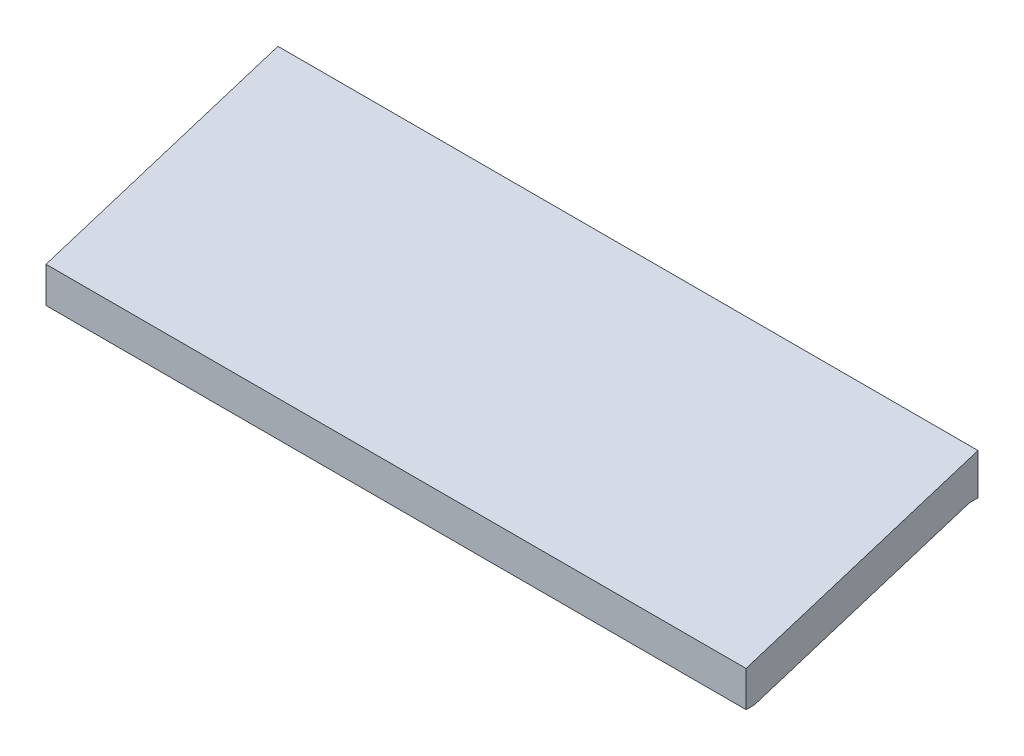
from build123d import *

# Parameters (mm, degrees)
BOSS_EXTRUDE2_DEPTH = 166
BOSS_EXTRUDE3_DEPTH = 2
BOSS_EXTRUDE4_DEPTH = 2


with BuildPart() as part:
    # Sketch2 → Boss-Extrude2 (new body)
    with BuildSketch(Plane(origin=(0, 0, 0), x_dir=(0, 0, -1), z_dir=(1, 0, 0))):
        Polygon((51, -1.737908105), (51, -8.737908105), (53, -8.737908105), (53, -1.737908105), (53, 0.985657074), (50.401319851, 0.17038487), (-0.598680149, -15.82961513), (-2, -16.269244887), (-2, -17.737908105), (-2, -24.737908105), (0, -24.737908105), (0, -22.737908105), (0, -17.737908105), align=None)
    extrude(amount=BOSS_EXTRUDE2_DEPTH)

    # Sketch3 → Boss-Extrude3 (add)
    with BuildSketch(Plane.ZY):
        Polygon((-51, -1.737908105), (0, -17.737908105), (0, -24.737908105), (-51, -8.737908105), align=None)
    extrude(amount=-BOSS_EXTRUDE3_DEPTH)

    # Sketch4 → Boss-Extrude4 (add)
    with BuildSketch(Plane(origin=(166, 0, 0), x_dir=(0, 0, -1), z_dir=(1, 0, 0))):
        Polygon((51, -1.737908105), (0, -17.737908105), (0, -24.737908105), (51, -8.737908105), align=None)
    extrude(amount=-BOSS_EXTRUDE4_DEPTH)


solid = part.part
